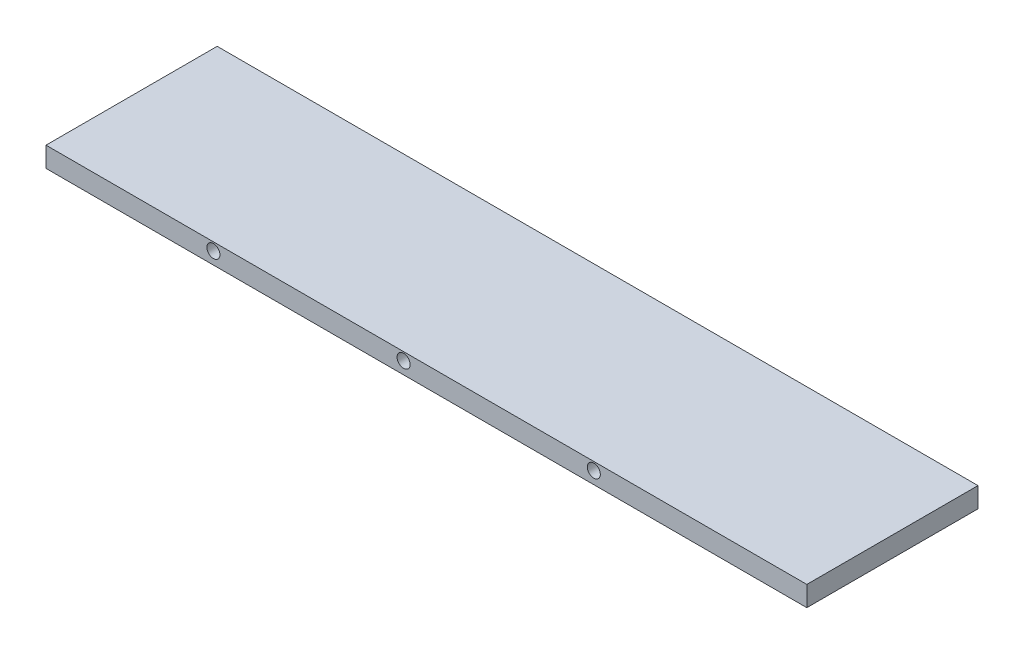
from build123d import *

# Parameters (mm, degrees)
SKETCH1_W                            = 254
SKETCH1_H                            = 57.15
SKETCH1_R                            = 10
BOSS_EXTRUDE1_DEPTH                  = 6.730000002
SKETCH25_R                           = 10.25
CUT_EXTRUDE1_DEPTH                   = 7.6
SKETCH26_W                           = 254
SKETCH26_H                           = 57.15
BOSS_EXTRUDE2_DEPTH                  = 0.4
F_11_64_0_17188_DIAMETER_HOLE1_D     = 4.365752
F_11_64_0_17188_DIAMETER_HOLE1_DEPTH = 6.35
F_11_64_0_17188_DIAMETER_HOLE1_TIP   = 1.311604225
F_11_64_0_17188_DIAMETER_HOLE2_D     = 4.365752
F_11_64_0_17188_DIAMETER_HOLE2_DEPTH = 6.35
F_11_64_0_17188_DIAMETER_HOLE2_TIP   = 1.311604225


with BuildPart() as part:
    # Sketch1 → Boss-Extrude1 (new body)
    with BuildSketch(Plane(origin=(0, 0, 0), x_dir=(1, 0, 0), z_dir=(0, 1, 0))):
        with Locations((92.969183673, -14.086632653)):
            Rectangle(SKETCH1_W, SKETCH1_H)
        with Locations(Location((202.969183673, 0.518367347, 0), (0, 0, 270))):
            Circle(SKETCH1_R, mode=Mode.SUBTRACT)
        with Locations(Location((171.219183673, 0.518367347, 0), (0, 0, 270))):
            Circle(SKETCH1_R, mode=Mode.SUBTRACT)
        with Locations(Location((139.469183673, 0.518367347, 0), (0, 0, 270))):
            Circle(SKETCH1_R, mode=Mode.SUBTRACT)
        with Locations(Location((107.719183673, 0.518367347, 0), (0, 0, 270))):
            Circle(SKETCH1_R, mode=Mode.SUBTRACT)
        with Locations(Location((75.969183673, 0.518367347, 0), (0, 0, 270))):
            Circle(SKETCH1_R, mode=Mode.SUBTRACT)
        with Locations(Location((44.219183673, 0.518367347, 0), (0, 0, 270))):
            Circle(SKETCH1_R, mode=Mode.SUBTRACT)
        with Locations(Location((171.219183673, -22.341632653, 0), (0, 0, 270))):
            Circle(SKETCH1_R, mode=Mode.SUBTRACT)
        with Locations(Location((139.469183673, -22.341632653, 0), (0, 0, 270))):
            Circle(SKETCH1_R, mode=Mode.SUBTRACT)
        with Locations(Location((107.719183673, -22.341632653, 0), (0, 0, 270))):
            Circle(SKETCH1_R, mode=Mode.SUBTRACT)
        with Locations(Location((75.969183673, -22.341632653, 0), (0, 0, 270))):
            Circle(SKETCH1_R, mode=Mode.SUBTRACT)
        with Locations(Location((44.219183673, -22.341632653, 0), (0, 0, 270))):
            Circle(SKETCH1_R, mode=Mode.SUBTRACT)
        with Locations(Location((202.969183673, -22.341632653, 0), (0, 0, 270))):
            Circle(SKETCH1_R, mode=Mode.SUBTRACT)
        with Locations(Location((12.469183673, 0.518367347, 0), (0, 0, 270))):
            Circle(SKETCH1_R, mode=Mode.SUBTRACT)
        with Locations(Location((-19.280816327, 0.518367347, 0), (0, 0, 270))):
            Circle(SKETCH1_R, mode=Mode.SUBTRACT)
        with Locations(Location((12.469183673, -22.341632653, 0), (0, 0, 270))):
            Circle(SKETCH1_R, mode=Mode.SUBTRACT)
        with Locations(Location((-19.280816327, -22.341632653, 0), (0, 0, 270))):
            Circle(SKETCH1_R, mode=Mode.SUBTRACT)
    extrude(amount=BOSS_EXTRUDE1_DEPTH)

    # Sketch25 → Cut-Extrude1 (cut)
    with BuildSketch(Plane.XZ):
        with Locations(Location((44.219183673, 22.341632653, 0), (0, 0, 270))):
            Circle(SKETCH25_R)
        with Locations(Location((75.969183673, 22.341632653, 0), (0, 0, 270))):
            Circle(SKETCH25_R)
        with Locations(Location((107.719183673, 22.341632653, 0), (0, 0, 270))):
            Circle(SKETCH25_R)
        with Locations(Location((139.469183673, 22.341632653, 0), (0, 0, 270))):
            Circle(SKETCH25_R)
        with Locations(Location((171.219183673, 22.341632653, 0), (0, 0, 270))):
            Circle(SKETCH25_R)
        with Locations(Location((202.969183673, 22.341632653, 0), (0, 0, 270))):
            Circle(SKETCH25_R)
        with Locations(Location((75.969183673, -0.518367347, 0), (0, 0, 270))):
            Circle(SKETCH25_R)
        with Locations(Location((107.719183673, -0.518367347, 0), (0, 0, 270))):
            Circle(SKETCH25_R)
        with Locations(Location((139.469183673, -0.518367347, 0), (0, 0, 270))):
            Circle(SKETCH25_R)
        with Locations(Location((171.219183673, -0.518367347, 0), (0, 0, 270))):
            Circle(SKETCH25_R)
        with Locations(Location((202.969183673, -0.518367347, 0), (0, 0, 270))):
            Circle(SKETCH25_R)
        with Locations(Location((44.219183673, -0.518367347, 0), (0, 0, 270))):
            Circle(SKETCH25_R)
        with Locations(Location((12.469183673, 22.341632653, 0), (0, 0, 270))):
            Circle(SKETCH25_R)
        with Locations(Location((-19.280816327, 22.341632653, 0), (0, 0, 270))):
            Circle(SKETCH25_R)
        with Locations(Location((-19.280816327, -0.518367347, 0), (0, 0, 270))):
            Circle(SKETCH25_R)
        with Locations(Location((12.469183673, -0.518367347, 0), (0, 0, 270))):
            Circle(SKETCH25_R)
    extrude(amount=-CUT_EXTRUDE1_DEPTH, mode=Mode.SUBTRACT)

    # Sketch26 → Boss-Extrude2 (add)
    with BuildSketch(Plane(origin=(0, 6.730000002, 0), x_dir=(1, 0, 0), z_dir=(0, 1, 0))):
        with Locations((92.969183673, -14.086632653)):
            Rectangle(SKETCH26_W, SKETCH26_H)
    extrude(amount=-BOSS_EXTRUDE2_DEPTH)

    # 11/64 (0.17188) Diameter Hole1
    with Locations(Plane.XY.offset(42.661632653)):
        with Locations((21.849183673, 4.064), (148.849183673, 4.064), (85.349183673, 4.064)):
            Hole(F_11_64_0_17188_DIAMETER_HOLE1_D / 2, depth=F_11_64_0_17188_DIAMETER_HOLE1_DEPTH)
            with Locations((0, 0, -(F_11_64_0_17188_DIAMETER_HOLE1_DEPTH + F_11_64_0_17188_DIAMETER_HOLE1_TIP / 2))):  # 118° drill point
                Cone(0, F_11_64_0_17188_DIAMETER_HOLE1_D / 2, F_11_64_0_17188_DIAMETER_HOLE1_TIP, mode=Mode.SUBTRACT)

    # 11/64 (0.17188) Diameter Hole2
    with Locations(Plane(origin=(0, 0, -14.488367347), x_dir=(-1, 0, 0), z_dir=(0, 0, -1))):
        with Locations((-148.849183673, 4.064), (-85.349183673, 4.064), (-21.849183673, 4.064)):
            Hole(F_11_64_0_17188_DIAMETER_HOLE2_D / 2, depth=F_11_64_0_17188_DIAMETER_HOLE2_DEPTH)
            with Locations((0, 0, -(F_11_64_0_17188_DIAMETER_HOLE2_DEPTH + F_11_64_0_17188_DIAMETER_HOLE2_TIP / 2))):  # 118° drill point
                Cone(0, F_11_64_0_17188_DIAMETER_HOLE2_D / 2, F_11_64_0_17188_DIAMETER_HOLE2_TIP, mode=Mode.SUBTRACT)


solid = part.part
